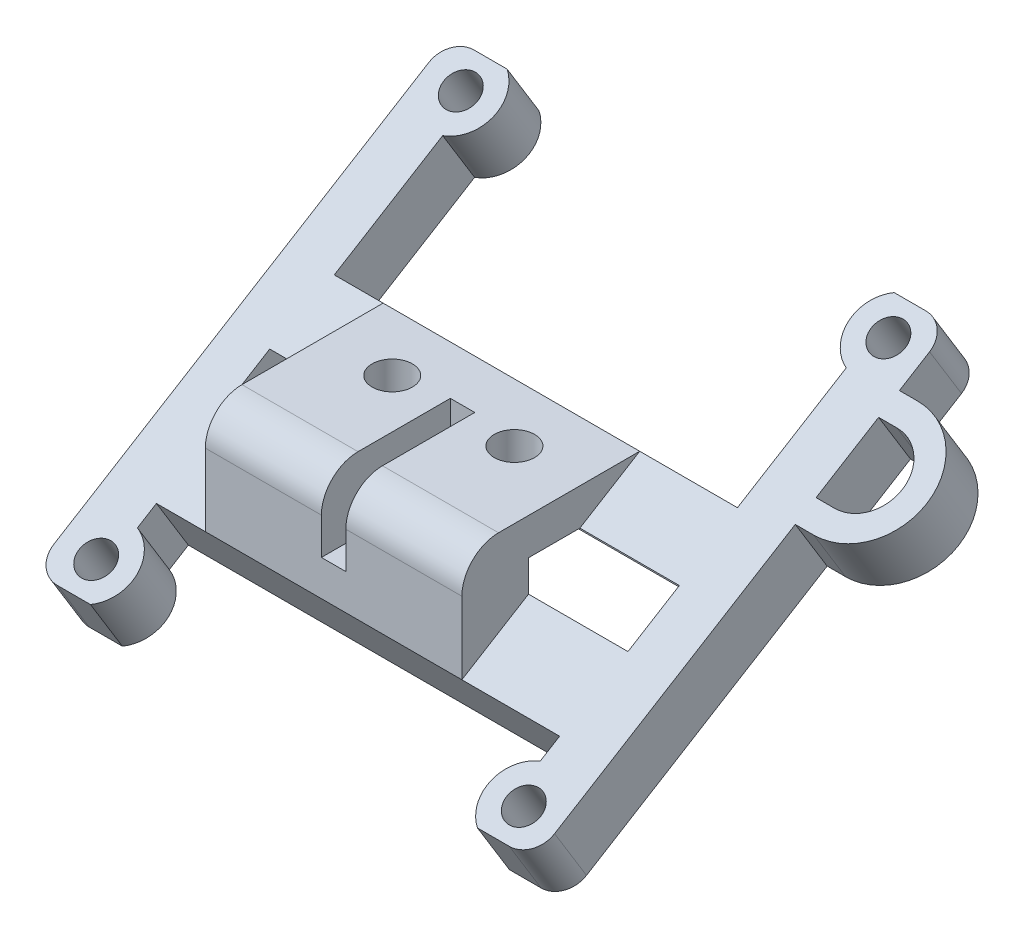
from build123d import *

# Parameters (mm, degrees)
SKETCH_1_W                  = 28
SKETCH_1_H                  = 15
EXTRUDE_1_DEPTH             = 5
EXTRUDE_2_DEPTH             = 13
EXTRUDE_2_DIRECTION_2_REACH = 34.156
CUT_EXTRUDE_1_DEPTH         = 53.098032867
SKETCH_8_W                  = 41
SKETCH_8_H                  = 40
EXTRUDE_3_DEPTH             = 2.5
SKETCH_4_R                  = 1.4
CUT_EXTRUDE_2_DEPTH         = 7
SKETCH_5_R                  = 1.65
CUT_EXTRUDE_3_DEPTH         = 45.800573211
SKETCH_6_W                  = 33.531677497
SKETCH_6_H                  = 7.773496997
CUT_EXTRUDE_4_DEPTH         = 11
FILLET_1_R                  = 2
CUT_EXTRUDE_5_DEPTH         = 44.302936624
SKETCH_10_W                 = 2
SKETCH_10_H                 = 11.556486704
CUT_EXTRUDE_6_DEPTH         = 6
CUT_EXTRUDE_8_DEPTH         = 8
CUT_EXTRUDE_9_DEPTH         = 12
FILLET_2_R                  = 3
EXTRUDE_4_DEPTH             = 5


with BuildPart() as part:
    # 草图1 → 凸台-拉伸1 (new body)
    with BuildSketch(Plane(origin=(0, 0, 0), x_dir=(1, 0, 0), z_dir=(0, 1, 0))):
        with Locations((14, 7.5)):
            Rectangle(SKETCH_1_W, SKETCH_1_H)
    extrude(amount=EXTRUDE_1_DEPTH)

    # 草图2 → 凸台-拉伸2 (add)
    with BuildSketch(Plane.ZY):
        Polygon((4.811400568, -9.800725827), (-29.294206006, 11.099216762), (-27.987959594, 13.230817173), (-14.556486704, 5), (0, 5), (0, 0), (0, -3.920226525), (6.11764698, -7.669125416), align=None)
    extrude(amount=EXTRUDE_2_DEPTH)

    # 凸台-拉伸2 direction 2: up to this face of the body (flat: up to its plane)
    extrude_2_direction_2_end = Plane(part.part.faces().sort_by_distance((28, 2.5, -7.5))[0])
    # 草图2 → 凸台-拉伸2 direction 2 (add, up to the picked face)
    with BuildSketch(Plane.ZY, mode=Mode.PRIVATE) as extrude_2_direction_2_sk1:
        Polygon((4.811400568, -9.800725827), (-29.294206006, 11.099216762), (-27.987959594, 13.230817173), (-14.556486704, 5), (0, 5), (0, 0), (0, -3.920226525), (6.11764698, -7.669125416), align=None)
    extrude_2_direction_2_tool1 = split(extrude(extrude_2_direction_2_sk1.sketch, amount=-EXTRUDE_2_DIRECTION_2_REACH, mode=Mode.PRIVATE), bisect_by=extrude_2_direction_2_end, keep=Keep.BOTH, mode=Mode.PRIVATE)
    add(extrude_2_direction_2_tool1.solids().sort_by(Axis((0, 1.837688, -8.936549), (1, 0, 0)))[0])

    # 草图3 → 切除-拉伸1 (cut, through all)
    with BuildSketch(Plane.ZY.offset(13)):
        Polygon((-15, 0), (-11.181930407, 0), (-15, 2.339716056), align=None)
    extrude(amount=-CUT_EXTRUDE_1_DEPTH, mode=Mode.SUBTRACT)

    # 草图8 → 凸台-拉伸3 (add)
    with BuildSketch(Plane(origin=(0, -4.981586473, -3.052720117), x_dir=(1, 0, 0), z_dir=(0, -0.8526401643540905, -0.5224985647159519))):
        with Locations((7.5, -10.776741451)):
            Rectangle(SKETCH_8_W, SKETCH_8_H)
    extrude(amount=EXTRUDE_3_DEPTH)

    # 草图4 → 切除-拉伸2 (cut)
    with BuildSketch(Plane(origin=(0, -7.113186884, -4.358966529), x_dir=(1, 0, 0), z_dir=(0, -0.8526401643540905, -0.5224985647159519))):
        with Locations(Location((-9.945229951, 6.723258549, 0), (0, 0, 270))):
            Circle(SKETCH_4_R)
        with Locations(Location((25.054770049, 6.723258549, 0), (0, 0, 270))):
            Circle(SKETCH_4_R)
        with Locations(Location((25.054770049, -28.276741451, 0), (0, 0, 270))):
            Circle(SKETCH_4_R)
        with Locations(Location((-9.945229951, -28.276741451, 0), (0, 0, 270))):
            Circle(SKETCH_4_R)
    extrude(amount=-CUT_EXTRUDE_2_DEPTH, mode=Mode.SUBTRACT)

    # 草图5 → 切除-拉伸3 (cut, through all)
    with BuildSketch(Plane(origin=(0, 5, 0), x_dir=(1, 0, 0), z_dir=(0, 1, 0))):
        with Locations(Location((10.5, 9.8, 0), (0, 0, 270))):
            Circle(SKETCH_5_R)
        with Locations(Location((0.5, 9.8, 0), (0, 0, 270))):
            Circle(SKETCH_5_R)
    extrude(amount=-CUT_EXTRUDE_3_DEPTH, mode=Mode.SUBTRACT)

    # 草图6 → 切除-拉伸4 (cut)
    with BuildSketch(Plane(origin=(0, 2, 0), x_dir=(1, 0, 0), z_dir=(0, 1, 0))):
        with Locations((7.374838624, 9.340740808)):
            Rectangle(SKETCH_6_W, SKETCH_6_H)
    extrude(amount=-CUT_EXTRUDE_4_DEPTH, mode=Mode.SUBTRACT)

    # 圆角1
    fillet_1_edges = [part.edges().sort_by_distance(p)[0] for p in [
        (28, 11.099216762, -29.294206006),
        (28, -9.800725827, 4.811400568),
        (-13, -9.800725827, 4.811400568),
        (-13, 11.099216762, -29.294206006),
    ]]
    fillet(fillet_1_edges, radius=FILLET_1_R)

    # 草图9 → 切除-拉伸5 (cut, through all)
    with BuildSketch(Plane(origin=(0, -2.849986062, -1.746473705), x_dir=(1, 0, 0), z_dir=(0, 0.8526401643540904, 0.5224985647159519))):
        with BuildLine():
            Line((-8.286917555, -9.223258549), (23.396457654, -9.223258549))
            ThreePointArc((23.396457654, -9.223258549), (22.073973693, -6.384358742), (24, -3.914796311))
            Line((24, -3.914796311), (24, -2.048312733))
            Line((24, -2.048312733), (-9, -2.048312733))
            Line((-9, -2.048312733), (-9, -3.876059866))
            ThreePointArc((-9, -3.876059866), (-6.971555183, -6.326700388), (-8.286917555, -9.223258549))
        make_face()
        with BuildLine():
            Line((-9, 19.02393804), (-9, 15.02393804))
            Line((-9, 15.02393804), (24, 15.02393804))
            Line((24, 15.02393804), (24, 19.02393804))
            Line((24, 19.02393804), (24, 25.468279213))
            ThreePointArc((24, 25.468279213), (22.073973693, 27.937841645), (23.396457654, 30.776741451))
            Line((23.396457654, 30.776741451), (-8.286917555, 30.776741451))
            ThreePointArc((-8.286917555, 30.776741451), (-6.971555183, 27.880183291), (-9, 25.429542768))
            Line((-9, 25.429542768), (-9, 19.02393804))
        make_face()
    extrude(amount=-CUT_EXTRUDE_5_DEPTH, mode=Mode.SUBTRACT)

    # 草图10 → 切除-拉伸6 (cut)
    with BuildSketch(Plane(origin=(0, 5, 0), x_dir=(1, 0, 0), z_dir=(0, 1, 0))):
        with Locations((5.501092332, 4.778243352)):
            Rectangle(SKETCH_10_W, SKETCH_10_H)
    extrude(amount=-CUT_EXTRUDE_6_DEPTH, mode=Mode.SUBTRACT)

    # 草图11 → 切除-拉伸8 (cut)
    with BuildSketch(Plane.ZY.offset(13)):
        Polygon((0, -3.920226525), (-14.556486704, 5), (0, 5), align=None)
    extrude(amount=-CUT_EXTRUDE_8_DEPTH, mode=Mode.SUBTRACT)

    # 草图12 → 切除-拉伸9 (cut)
    with BuildSketch(Plane(origin=(28, 0, 0), x_dir=(0, 0, -1), z_dir=(1, 0, 0))):
        Polygon((14.556486704, 5), (0, -3.920226525), (0, 5), align=None)
    extrude(amount=-CUT_EXTRUDE_9_DEPTH, mode=Mode.SUBTRACT)

    # 圆角2
    fillet_2_edges = [part.edges().sort_by_distance(p)[0] for p in [
        (11.250546166, 5, 0),
        (-0.249453834, 5, 0),
    ]]
    fillet(fillet_2_edges, radius=FILLET_2_R)

    # 草图13 → 凸台-拉伸4 (add)
    with BuildSketch(Plane(origin=(0, -7.113186884, -4.358966529), x_dir=(1, 0, 0), z_dir=(0, -0.8526401643540905, -0.5224985647159519))):
        with BuildLine():
            Line((27.203064282, -17.882084245), (29.512557602, -17.882084245))
            ThreePointArc((29.512557602, -17.882084245), (32.512557602, -20.882084245), (29.512557602, -23.882084245))
            Line((29.512557602, -23.882084245), (27.203064282, -23.882084245))
            Line((27.203064282, -23.882084245), (27.203064282, -25.882084245))
            Line((27.203064282, -25.882084245), (29.512557602, -25.882084245))
            ThreePointArc((29.512557602, -25.882084245), (34.512557602, -20.882084245), (29.512557602, -15.882084245))
            Line((29.512557602, -15.882084245), (27.203064282, -15.882084245))
            Line((27.203064282, -15.882084245), (27.203064282, -17.882084245))
        make_face()
    extrude(amount=-EXTRUDE_4_DEPTH)


solid = part.part
